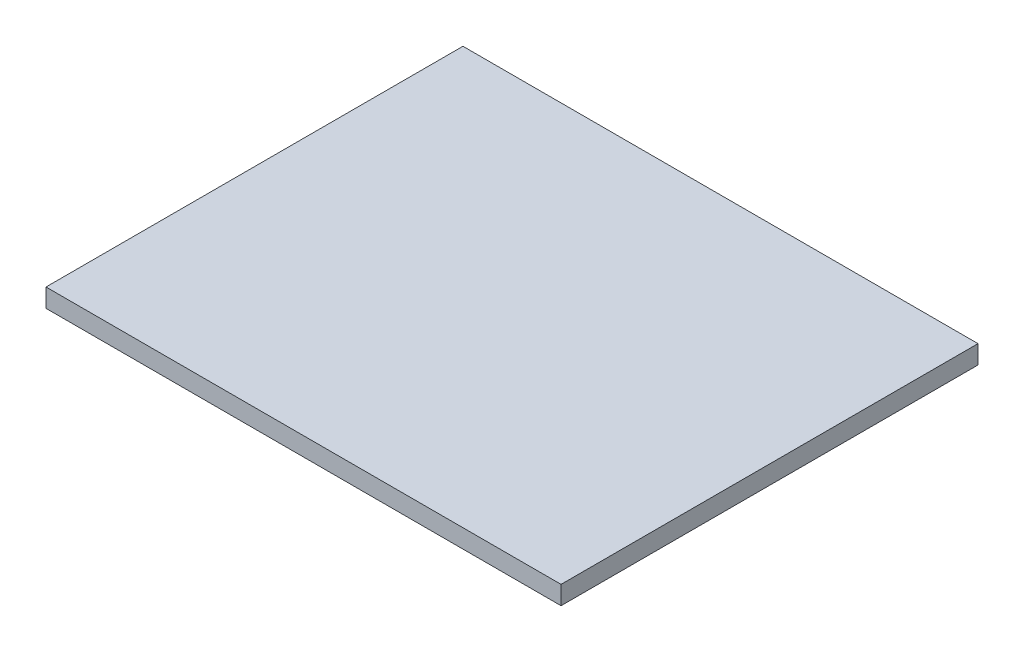
from build123d import *

# Parameters (mm, degrees)
SKETCH1_W           = 200.5584
SKETCH1_H           = 162.3568
BOSS_EXTRUDE1_DEPTH = 7.2136


with BuildPart() as part:
    # Sketch1 → Boss-Extrude1 (new body)
    with BuildSketch(Plane(origin=(0, 0, 0), x_dir=(1, 0, 0), z_dir=(0, 1, 0))):
        with Locations((54.486535415, -44.261267707)):
            Rectangle(SKETCH1_W, SKETCH1_H)
    extrude(amount=BOSS_EXTRUDE1_DEPTH)


solid = part.part
